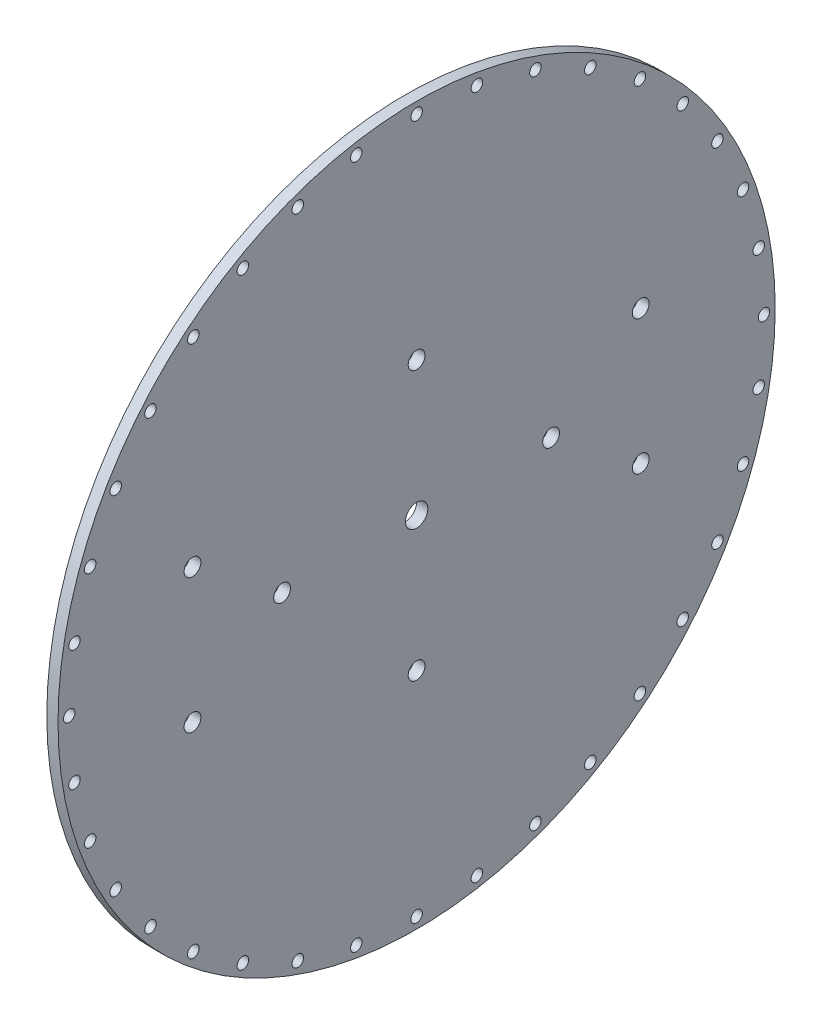
from build123d import *

# Parameters (mm, degrees)
SKETCH1_R                    = 203.2
BOSS_EXTRUDE1_DEPTH          = 6.35
F_0_257_DIAMETER_HOLE1_D     = 6.5278
CIRPATTERN1_COUNT            = 36
F_1_2_0_5_DIAMETER_HOLE1_D   = 12.7
F_3_8_0_375_DIAMETER_HOLE1_D = 9.525
CIRPATTERN2_COUNT            = 4
F_3_8_0_375_DIAMETER_HOLE2_D = 9.525
LPATTERN1_COUNT              = 2
LPATTERN1_PITCH              = 254
LPATTERN1_COUNT_DIR2         = 2
LPATTERN1_PITCH_DIR2         = 76.2


with BuildPart() as part:
    # Sketch1 → Boss-Extrude1 (new body)
    with BuildSketch(Plane(origin=(0, 0, 0), x_dir=(0, 0, -1), z_dir=(1, 0, 0))):
        Circle(SKETCH1_R)
    extrude(amount=BOSS_EXTRUDE1_DEPTH)

    # F (0.257) Diameter Hole1 (through all)
    with Locations(Plane(origin=(6.35, 0, 0), x_dir=(0, 0, -1), z_dir=(1, 0, 0))):
        with Locations((-196.85, 0)):
            f_0_257_diameter_hole1 = Hole(F_0_257_DIAMETER_HOLE1_D / 2)

    # CirPattern1: F (0.257) Diameter Hole1 ×36 about axis
    cirpattern1_axis = Axis((0, 0, 0), (-1, 0, 0))
    for i in range(1, CIRPATTERN1_COUNT):
        add(f_0_257_diameter_hole1.rotate(cirpattern1_axis, i * 360 / CIRPATTERN1_COUNT), mode=Mode.SUBTRACT)

    # 1/2 (0.5) Diameter Hole1 (through all)
    with Locations(Plane(origin=(6.35, 0, 0), x_dir=(0, 0, -1), z_dir=(1, 0, 0))):
        with Locations((0, 0)):
            Hole(F_1_2_0_5_DIAMETER_HOLE1_D / 2)

    # 3/8 (0.375) Diameter Hole1 (through all)
    with Locations(Plane(origin=(6.35, 0, 0), x_dir=(0, 0, -1), z_dir=(1, 0, 0))):
        with Locations((0, -76.2)):
            f_3_8_0_375_diameter_hole1 = Hole(F_3_8_0_375_DIAMETER_HOLE1_D / 2)

    # CirPattern2: 3/8 (0.375) Diameter Hole1 ×4 about axis
    cirpattern2_axis = Axis((0, 0, 0), (-1, 0, 0))
    for i in range(1, CIRPATTERN2_COUNT):
        add(f_3_8_0_375_diameter_hole1.rotate(cirpattern2_axis, i * 360 / CIRPATTERN2_COUNT), mode=Mode.SUBTRACT)

    # 3/8 (0.375) Diameter Hole2 (through all)
    with Locations(Plane(origin=(6.35, 0, 0), x_dir=(0, 0, -1), z_dir=(1, 0, 0))):
        with Locations((-127, -38.1)):
            f_3_8_0_375_diameter_hole2 = Hole(F_3_8_0_375_DIAMETER_HOLE2_D / 2)

    # LPattern1: 3_8 _0.375_ Diameter Hole2 2 × 2
    with Locations(*[(0, j * LPATTERN1_PITCH_DIR2, -i * LPATTERN1_PITCH) for i in range(LPATTERN1_COUNT) for j in range(LPATTERN1_COUNT_DIR2) if (i, j) != (0, 0)]):
        add(f_3_8_0_375_diameter_hole2, mode=Mode.SUBTRACT)


solid = part.part
